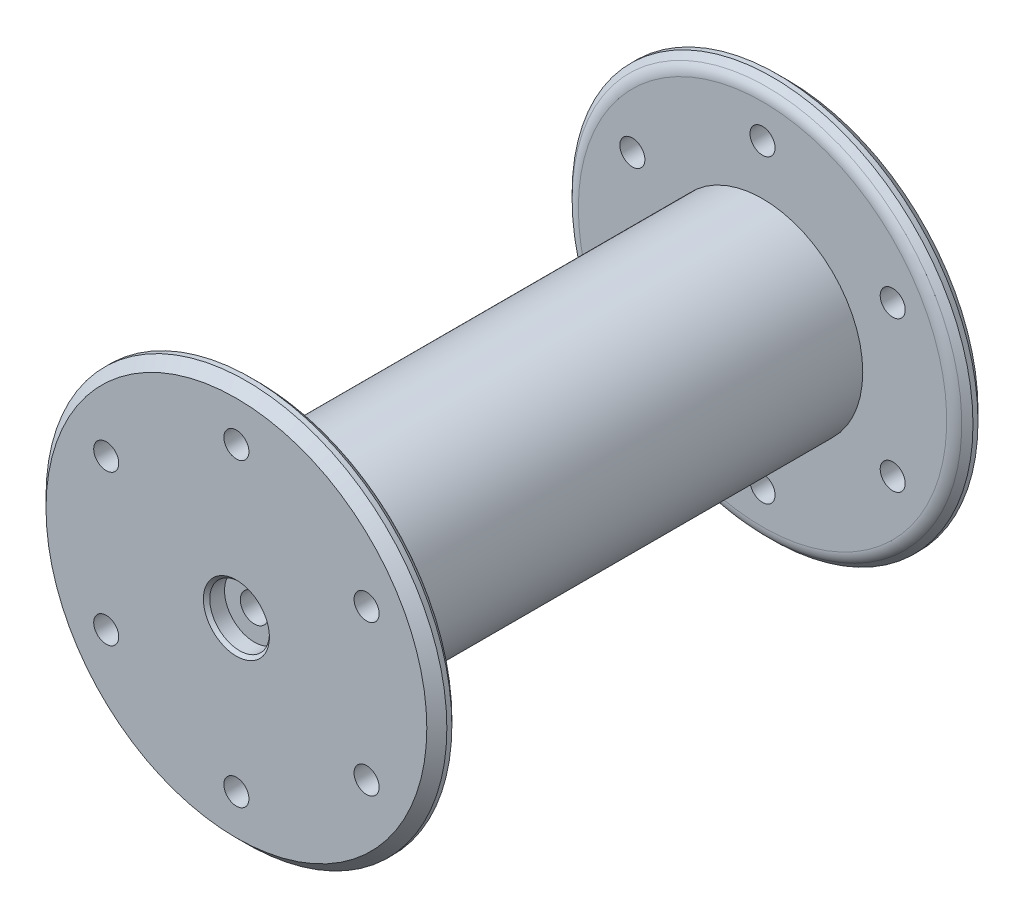
from build123d import *

# Parameters (mm, degrees)
SKETCH1_R                = 20
BOSS_EXTRUDE1_DEPTH      = 50
SKETCH3_R                = 40
BOSS_EXTRUDE2_DEPTH      = 5
CHAMFER1_SIZE            = 2
SKETCH5_R                = 2.5
CUT_EXTRUDE1_DEPTH       = 120.268604419
CIRPATTERN1_COUNT        = 6
FILLET2_R                = 3
MIRROR3_COPY_1_SKETCH_R  = 2.5
MIRROR3_COPY_1_DEPTH     = 120.268604419
MIRROR3_COPY_2_SKETCH_R  = 2.5
MIRROR3_COPY_2_DEPTH     = 120.268604419
MIRROR3_COPY_3_SKETCH_R  = 2.5
MIRROR3_COPY_3_DEPTH     = 120.268604419
MIRROR3_COPY_4_SKETCH_R  = 2.5
MIRROR3_COPY_4_DEPTH     = 120.268604419
MIRROR3_COPY_5_SKETCH_R  = 2.5
MIRROR3_COPY_5_DEPTH     = 120.268604419
CHAMFER1_OF_MIRROR3_SIZE = 2
FILLET2_OF_MIRROR3_R     = 3


with BuildPart() as part:
    # Sketch1 → Boss-Extrude1 (new, symmetric)
    with BuildSketch(Plane.XY):
        Circle(SKETCH1_R)
    boss_extrude1 = extrude(amount=BOSS_EXTRUDE1_DEPTH, both=True)

    # Sketch3 → Boss-Extrude2 (add)
    with BuildSketch(Plane.XY.offset(50)):
        Circle(SKETCH3_R)
    boss_extrude2 = extrude(amount=BOSS_EXTRUDE2_DEPTH)

    # Chamfer1
    chamfer1_edges = [part.edges().sort_by_distance(p)[0] for p in [
        (-40, 0, 50),
        (-40, 0, 55),
    ]]
    chamfer(chamfer1_edges, length=CHAMFER1_SIZE)

    # Sketch5 → Cut-Extrude1 (cut, through all)
    with BuildSketch(Plane.XY.offset(55)):
        with Locations((0, 30)):
            Circle(SKETCH5_R)
    cut_extrude1 = extrude(amount=-CUT_EXTRUDE1_DEPTH, mode=Mode.SUBTRACT)

    # CirPattern1: Cut-Extrude1 ×6 about axis
    cirpattern1_axis = Axis((0, 0, 0), (0, 0, 1))
    for i in range(1, CIRPATTERN1_COUNT):
        add(cut_extrude1.rotate(cirpattern1_axis, i * 360 / CIRPATTERN1_COUNT), mode=Mode.SUBTRACT)

    # Fillet2
    fillet2_edges = [part.edges().sort_by_distance(p)[0] for p in [
        (-38, 0, 50),
    ]]
    fillet(fillet2_edges, radius=FILLET2_R)

    # Sketch8 → CBORE for #12 Binding Head Machine Screw1 (revolve, cut)
    with BuildSketch(Plane(origin=(0, 0, 55), x_dir=(0, -1, 0), z_dir=(1, 0, 0))):
        Polygon((0, 0), (0, 110), (2.8067, 110), (2.8067, 3.5814), (5.95376, 3.5814), (5.95376, 0.635), (6.58876, 0), align=None)
    cbore_for_12_binding_head_machine_screw = revolve(axis=Axis((0, 0, 61.35), (0, 0, -1)), mode=Mode.SUBTRACT)

    # Mirror3: Boss-Extrude1, Boss-Extrude2, Cut-Extrude1, CBORE for #12 Binding Head Machine Screw1 across plane
    add(boss_extrude1.mirror(Plane.XY))
    add(boss_extrude2.mirror(Plane.XY))
    add(cut_extrude1.mirror(Plane.XY), mode=Mode.SUBTRACT)
    add(cbore_for_12_binding_head_machine_screw.mirror(Plane.XY), mode=Mode.SUBTRACT)

    # Mirror3 copy 1 sketch → Mirror3 copy 1 (cut, through all)
    with BuildSketch(Plane(origin=(0, 0, -55), x_dir=(0.5000000000000001, 0.8660254037844386, 0), z_dir=(0, 0, -1))):
        with Locations((0, -30)):
            Circle(MIRROR3_COPY_1_SKETCH_R)
    extrude(amount=-MIRROR3_COPY_1_DEPTH, mode=Mode.SUBTRACT)

    # Mirror3 copy 2 sketch → Mirror3 copy 2 (cut, through all)
    with BuildSketch(Plane(origin=(0, 0, -55), x_dir=(-0.4999999999999998, 0.8660254037844387, 0), z_dir=(0, 0, -1))):
        with Locations((0, -30)):
            Circle(MIRROR3_COPY_2_SKETCH_R)
    extrude(amount=-MIRROR3_COPY_2_DEPTH, mode=Mode.SUBTRACT)

    # Mirror3 copy 3 sketch → Mirror3 copy 3 (cut, through all)
    with BuildSketch(Plane(origin=(0, 0, -55), x_dir=(-1, 0, 0), z_dir=(0, 0, -1))):
        with Locations((0, -30)):
            Circle(MIRROR3_COPY_3_SKETCH_R)
    extrude(amount=-MIRROR3_COPY_3_DEPTH, mode=Mode.SUBTRACT)

    # Mirror3 copy 4 sketch → Mirror3 copy 4 (cut, through all)
    with BuildSketch(Plane(origin=(0, 0, -55), x_dir=(-0.5000000000000004, -0.8660254037844384, 0), z_dir=(0, 0, -1))):
        with Locations((0, -30)):
            Circle(MIRROR3_COPY_4_SKETCH_R)
    extrude(amount=-MIRROR3_COPY_4_DEPTH, mode=Mode.SUBTRACT)

    # Mirror3 copy 5 sketch → Mirror3 copy 5 (cut, through all)
    with BuildSketch(Plane(origin=(0, 0, -55), x_dir=(0.5000000000000001, -0.8660254037844386, 0), z_dir=(0, 0, -1))):
        with Locations((0, -30)):
            Circle(MIRROR3_COPY_5_SKETCH_R)
    extrude(amount=-MIRROR3_COPY_5_DEPTH, mode=Mode.SUBTRACT)

    # Chamfer1 of Mirror3
    chamfer1_of_mirror3_edges = [part.edges().sort_by_distance(p)[0] for p in [
        (-40, 0, -50),
        (-40, 0, -55),
    ]]
    chamfer(chamfer1_of_mirror3_edges, length=CHAMFER1_OF_MIRROR3_SIZE)

    # Fillet2 of Mirror3
    fillet2_of_mirror3_edges = [part.edges().sort_by_distance(p)[0] for p in [
        (-38, 0, -50),
    ]]
    fillet(fillet2_of_mirror3_edges, radius=FILLET2_OF_MIRROR3_R)


solid = part.part
